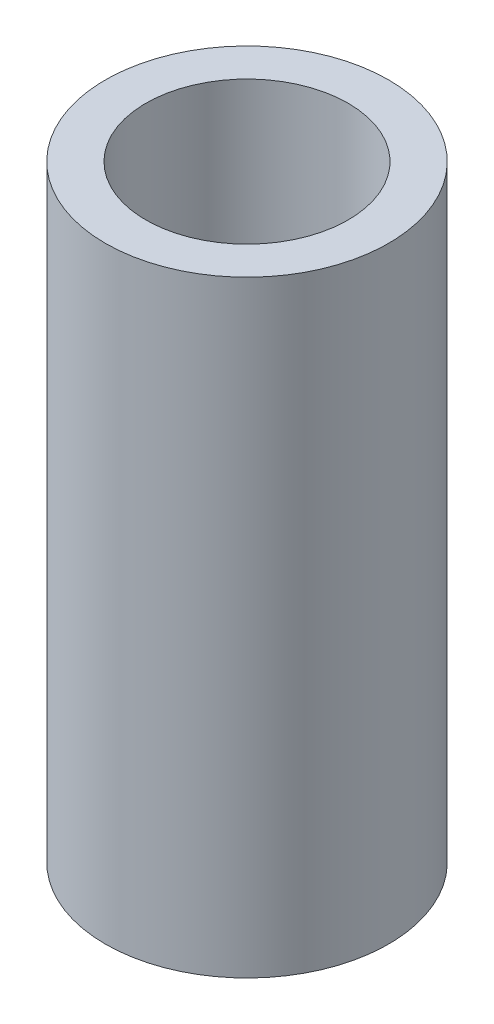
from build123d import *

# Parameters (mm, degrees)
SKETCH1_R           = 4.445
SKETCH1_R_2         = 3.175
BOSS_EXTRUDE1_DEPTH = 19.05


with BuildPart() as part:
    # Sketch1 → Boss-Extrude1 (new body)
    with BuildSketch(Plane(origin=(0, 0, 0), x_dir=(1, 0, 0), z_dir=(0, 1, 0))):
        with Locations(Location((0, 0, 0), (0, 0, 90))):
            Circle(SKETCH1_R)
        with Locations(Location((0, 0, 0), (0, 0, 90))):
            Circle(SKETCH1_R_2, mode=Mode.SUBTRACT)
    extrude(amount=BOSS_EXTRUDE1_DEPTH)


solid = part.part
